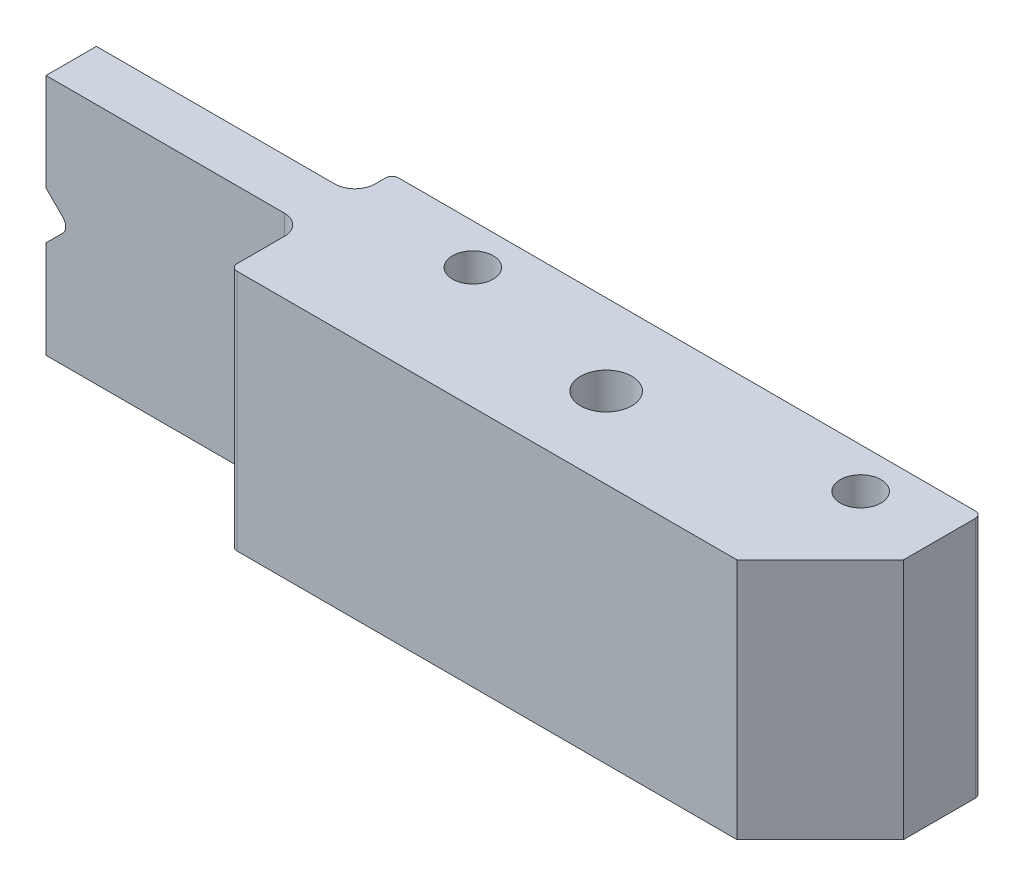
from build123d import *

# Parameters (mm, degrees)
CROQUIS1_W                          = 66.675
CROQUIS1_H                          = 19.05
SALIENTE_EXTRUIR1_DEPTH             = 12.7
CROQUIS2_W                          = 20.32
CROQUIS2_H                          = 2.921
CROQUIS2_H_2                        = 5.8166
CORTAR_EXTRUIR1_DEPTH               = 71.496440513
REDONDEO1_R                         = 1.5875
TALADROS_DE_ESPIGA_DE_1_8_0_126_1_D = 3.2004
TALADRO_ROSCADO_10_321_D            = 4.0386
CORTAR_EXTRUIR2_DEPTH               = 71.496440513
CORTAR_EXTRUIR3_DEPTH               = 71.02918653
CROQUIS10_W                         = 1.346153846
CROQUIS10_H                         = 0.358974359
CORTAR_EXTRUIR4_DEPTH               = 0.381
REDONDEO2_R                         = 0.508


with BuildPart() as part:
    # Croquis1 → Saliente-Extruir1 (new body)
    with BuildSketch(Plane.XY):
        with Locations((33.3375, -9.525)):
            Rectangle(CROQUIS1_W, CROQUIS1_H)
    extrude(amount=SALIENTE_EXTRUIR1_DEPTH)

    # Croquis2 → Cortar-Extruir1 (cut, through all)
    with BuildSketch(Plane(origin=(0, 0, 0), x_dir=(1, 0, 0), z_dir=(0, 1, 0))):
        with Locations((10.16, -1.4605)):
            Rectangle(CROQUIS2_W, CROQUIS2_H)
        with Locations((10.16, -9.7917)):
            Rectangle(CROQUIS2_W, CROQUIS2_H_2)
    extrude(amount=-CORTAR_EXTRUIR1_DEPTH, mode=Mode.SUBTRACT)

    # Redondeo1
    redondeo1_edges = [part.edges().sort_by_distance(p)[0] for p in [
        (20.32, -9.525, 2.921),
        (20.32, -9.525, 6.8834),
    ]]
    fillet(redondeo1_edges, radius=REDONDEO1_R)

    # Taladros de espiga de 1/8 (0.126)1 (through all)
    with Locations(Plane(origin=(0, 0, 0), x_dir=(1, 0, 0), z_dir=(0, 1, 0))):
        with Locations((60.325, -3.175), (29.845, -3.175)):
            Hole(TALADROS_DE_ESPIGA_DE_1_8_0_126_1_D / 2)

    # Taladro roscado #10-321 (through all)
    with Locations(Plane(origin=(0, 0, 0), x_dir=(1, 0, 0), z_dir=(0, 1, 0))):
        with Locations((43.4975, -6.35)):
            Hole(TALADRO_ROSCADO_10_321_D / 2)

    # Croquis7 → Cortar-Extruir2 (cut, through all)
    with BuildSketch(Plane(origin=(0, 0, 0), x_dir=(1, 0, 0), z_dir=(0, 1, 0))):
        Polygon((66.675, -6.1468), (60.1218, -12.7), (66.675, -12.7), align=None)
    extrude(amount=-CORTAR_EXTRUIR2_DEPTH, mode=Mode.SUBTRACT)

    # Croquis8 → Cortar-Extruir3 (cut, through all)
    with BuildSketch(Plane(origin=(0, 0, 2.921), x_dir=(-1, 0, 0), z_dir=(0, 0, -1))):
        with BuildLine():
            Line((0, -7.659969265), (-1.326215367, -8.986184633))
            ThreePointArc((-1.326215367, -8.986184633), (-1.5494, -9.525), (-1.326215367, -10.063815367))
            Line((-1.326215367, -10.063815367), (0, -11.390030735))
            Line((0, -11.390030735), (0, -7.659969265))
        make_face()
    extrude(amount=-CORTAR_EXTRUIR3_DEPTH, mode=Mode.SUBTRACT)

    # Croquis10 → Cortar-Extruir4 (cut)
    # profile 1 of 12: a face of its own
    with BuildSketch(Plane(origin=(0, 0, 0), x_dir=(-1, 0, 0), z_dir=(0, 0, -1))):
        Polygon((-61.432842809, -12.7), (-60.970803546, -9.2), (-60.925931751, -9.2), (-59.480919732, -12.071794872), (-58.039413321, -9.2), (-57.993840405, -9.2), (-57.528996655, -12.7), (-57.844501463, -12.7), (-58.17963768, -10.181570513), (-59.443059155, -12.7), (-59.513872456, -12.7), (-60.782201783, -10.175961538), (-61.116636879, -12.7), align=None)
    # profile 2 of 12: a face of its own
    with BuildSketch(Plane(origin=(0, 0, 0), x_dir=(-1, 0, 0), z_dir=(0, 0, -1))):
        Polygon((-56.990535116, -12.7), (-56.528495854, -9.2), (-56.483624059, -9.2), (-55.038612039, -12.071794872), (-53.597105629, -9.2), (-53.551532713, -9.2), (-53.086688963, -12.7), (-53.40219377, -12.7), (-53.737329988, -10.181570513), (-55.000751463, -12.7), (-55.071564764, -12.7), (-56.339894091, -10.175961538), (-56.674329187, -12.7), align=None)
    # profile 3 of 12: a face of its own
    with BuildSketch(Plane(origin=(0, 0, 0), x_dir=(-1, 0, 0), z_dir=(0, 0, -1))):
        with BuildLine():
            Line((-50.57386845, -12.78974359), (-50.824870052, -12.615164263))
            Line((-50.824870052, -12.615164263), (-49.851713001, -11.192588141))
            add(Edge.make_bspline(
                [(-49.851713001, -11.192588141), (-49.913803737, -11.200181204), (-50.036063857, -11.215132369), (-50.159200959, -11.217879024), (-50.219801943, -11.219230769)],
                knots=[0, 0, 0, 0, 1.015715272, 2, 2, 2, 2], degree=3))
            add(Edge.make_bspline(
                [(-50.219801943, -11.219230769), (-50.256543991, -11.218289693), (-50.328665418, -11.216442442), (-50.43469707, -11.201800634), (-50.536582631, -11.179250506), (-50.634051987, -11.145601751), (-50.727471492, -11.103783542), (-50.816637205, -11.051926528), (-50.901429096, -10.990920237), (-50.980936506, -10.921087245), (-51.053248245, -10.844409193), (-51.117671542, -10.76325355), (-51.171212674, -10.676677579), (-51.21568926, -10.586447359), (-51.249419713, -10.491266009), (-51.273982251, -10.392216608), (-51.289104605, -10.288604966), (-51.290903701, -10.218079836), (-51.291817168, -10.182271635)],
                knots=[0, 0, 0, 0, 1.060718605, 2.082097864, 3.085795603, 4.069760067, 5.054557537, 6.03741023, 7.043284206, 8.066802108, 9.088538119, 10.083643548, 11.053783639, 12.022749082, 12.983451788, 13.964007469, 14.966251758, 16, 16, 16, 16], degree=3))
            add(Edge.make_bspline(
                [(-51.291817168, -10.182271635), (-51.290082733, -10.133302982), (-51.286678389, -10.03718745), (-51.259279872, -9.896753681), (-51.214219533, -9.763967138), (-51.151391156, -9.639176944), (-51.072256435, -9.524178205), (-50.977147844, -9.420569595), (-50.86664388, -9.329824742), (-50.743261861, -9.251820664), (-50.60990884, -9.189085667), (-50.470240182, -9.142846366), (-50.325326062, -9.115647619), (-50.227158392, -9.112061757), (-50.177734636, -9.11025641)],
                knots=[0, 0, 0, 0, 1.022988612, 2.007919123, 2.978103895, 3.94594894, 4.918897164, 5.887013414, 6.875921846, 7.89917871, 8.930658928, 9.948724884, 10.967259574, 12, 12, 12, 12], degree=3))
            add(Edge.make_bspline(
                [(-50.177734636, -9.11025641), (-50.129246216, -9.112086573), (-50.033437669, -9.115702803), (-49.892548663, -9.142186772), (-49.757607646, -9.186823445), (-49.629362659, -9.248508009), (-49.510623247, -9.325828916), (-49.403847436, -9.41796344), (-49.311471896, -9.524968967), (-49.233648016, -9.644257457), (-49.171177975, -9.772424439), (-49.126105692, -9.906208361), (-49.098360053, -10.044647082), (-49.094863726, -10.138441556), (-49.093099219, -10.185777244)],
                knots=[0, 0, 0, 0, 1.026385292, 2.028040595, 3.023318987, 4.028184125, 5.03290303, 6.015178782, 7.004435299, 8.016004309, 9.023023918, 10.015172535, 10.998308025, 12, 12, 12, 12], degree=3))
            add(Edge.make_bspline(
                [(-49.093099219, -10.185777244), (-49.094277628, -10.222521011), (-49.096667736, -10.297046551), (-49.113404043, -10.410276894), (-49.141824228, -10.525728124), (-49.174075927, -10.623449719), (-49.205208094, -10.704158169), (-49.234509226, -10.767909749), (-49.26702138, -10.835011013), (-49.304940145, -10.90475835), (-49.345702442, -10.978040885), (-49.391761718, -11.054123601), (-49.44206729, -11.133108594), (-49.47789701, -11.186355682), (-49.496244251, -11.213621795)],
                knots=[0, 0, 0, 0, 1.179839688, 2.393009684, 3.667231171, 4.993948276, 5.694988576, 6.444077775, 7.246288328, 8.089075292, 8.993003841, 9.939041771, 10.944649915, 12, 12, 12, 12], degree=3))
            Line((-49.496244251, -11.213621795), (-50.57386845, -12.78974359))
        make_face()
        with BuildLine():
            add(Edge.make_bspline(
                [(-50.161608834, -10.86025641), (-50.13377482, -10.859496026), (-50.079591457, -10.858015818), (-50.000214158, -10.849006576), (-49.925289955, -10.83303259), (-49.854618705, -10.810112878), (-49.787491803, -10.782456209), (-49.724975475, -10.747244223), (-49.6670174, -10.705227588), (-49.613229473, -10.658017572), (-49.565465473, -10.605566989), (-49.522922443, -10.550669882), (-49.486761875, -10.493085272), (-49.458198598, -10.43209201), (-49.434714023, -10.369174801), (-49.418496011, -10.303320446), (-49.409511677, -10.234872045), (-49.407980102, -10.188373387), (-49.407201783, -10.16474359)],
                knots=[0, 0, 0, 0, 1.163407946, 2.26475976, 3.333800367, 4.359385343, 5.366239384, 6.363380779, 7.350133999, 8.353570782, 9.349036268, 10.310270964, 11.253520213, 12.184142, 13.120487599, 14.056272588, 15.012232024, 16, 16, 16, 16], degree=3))
            add(Edge.make_bspline(
                [(-49.407201783, -10.16474359), (-49.407871452, -10.141103925), (-49.409191117, -10.094519065), (-49.419778417, -10.025969325), (-49.43840364, -9.960276064), (-49.463394125, -9.897079634), (-49.496314363, -9.836899262), (-49.535817849, -9.77897939), (-49.582750298, -9.723687262), (-49.636752865, -9.672323279), (-49.694987418, -9.62497538), (-49.757047918, -9.583189304), (-49.822422834, -9.548168107), (-49.890713324, -9.519269137), (-49.962061673, -9.496717362), (-50.036425661, -9.480499997), (-50.114181066, -9.471528243), (-50.166962352, -9.470006348), (-50.193860437, -9.469230769)],
                knots=[0, 0, 0, 0, 0.972161553, 1.915763587, 2.844109794, 3.775983486, 4.705125789, 5.659731448, 6.655561913, 7.682237399, 8.721216875, 9.739758359, 10.754845918, 11.767244016, 12.7857855, 13.828538656, 14.893392813, 16, 16, 16, 16], degree=3))
            add(Edge.make_bspline(
                [(-50.193860437, -9.469230769), (-50.22052459, -9.470007601), (-50.27283944, -9.471531738), (-50.349903599, -9.480482943), (-50.423764767, -9.496826428), (-50.494906387, -9.519258691), (-50.563194848, -9.548170263), (-50.62856668, -9.583191139), (-50.690641697, -9.624965761), (-50.748820418, -9.672360533), (-50.80291834, -9.72344818), (-50.849043869, -9.779221608), (-50.888637761, -9.836869133), (-50.921512764, -9.897087641), (-50.946515281, -9.960273927), (-50.965137283, -10.025969904), (-50.975725448, -10.094518914), (-50.977044995, -10.141103874), (-50.977714604, -10.16474359)],
                knots=[0, 0, 0, 0, 1.099389452, 2.15699305, 3.192601482, 4.213358962, 5.227959689, 6.245255729, 7.266013209, 8.307253147, 9.336162325, 10.327954924, 11.284637477, 12.215801273, 13.149702402, 14.080068371, 15.025723358, 16, 16, 16, 16], degree=3))
            add(Edge.make_bspline(
                [(-50.977714604, -10.16474359), (-50.977108677, -10.188391788), (-50.97591368, -10.235030365), (-50.964385891, -10.303556758), (-50.945107611, -10.369244952), (-50.91928822, -10.432733659), (-50.88528663, -10.493405517), (-50.843562782, -10.550972879), (-50.794657236, -10.606088329), (-50.739223748, -10.657895541), (-50.678555587, -10.705447716), (-50.613758841, -10.746978098), (-50.545949004, -10.782050543), (-50.474887374, -10.810191927), (-50.401100574, -10.83280359), (-50.323925442, -10.848977135), (-50.243617205, -10.857929402), (-50.189207223, -10.859473299), (-50.161608834, -10.86025641)],
                knots=[0, 0, 0, 0, 0.952633368, 1.87876736, 2.791047057, 3.707742249, 4.635551637, 5.587206343, 6.568248508, 7.601284464, 8.641511608, 9.671105535, 10.699146789, 11.713763218, 12.747829548, 13.806491675, 14.887386225, 16, 16, 16, 16], degree=3))
        make_face(mode=Mode.SUBTRACT)
    # profile 4 of 12: a face of its own
    with BuildSketch(Plane(origin=(0, 0, 0), x_dir=(-1, 0, 0), z_dir=(0, 0, -1))):
        with BuildLine():
            add(Edge.make_bspline(
                [(-48.64438127, -10.951402244), (-48.644053252, -10.895304856), (-48.643416072, -10.786334872), (-48.636327651, -10.62755023), (-48.624552309, -10.478589941), (-48.608414936, -10.339446875), (-48.588776956, -10.21008511), (-48.562561469, -10.090850353), (-48.532748667, -9.981190746), (-48.498196221, -9.880748698), (-48.459208432, -9.788170995), (-48.416774171, -9.701745793), (-48.369209377, -9.621603861), (-48.319232464, -9.546466071), (-48.264820392, -9.477562376), (-48.207521602, -9.413919713), (-48.145099725, -9.357008963), (-48.079676717, -9.305162661), (-48.010660253, -9.259713189), (-47.940017586, -9.21968045), (-47.867262481, -9.185480583), (-47.792196298, -9.158590147), (-47.71549374, -9.1363793), (-47.636886673, -9.121190353), (-47.556245309, -9.111633444), (-47.501813874, -9.110719776), (-47.474208995, -9.11025641)],
                knots=[0, 0, 0, 0, 1.646270934, 3.197905019, 4.663502075, 6.030701355, 7.308322542, 8.50163776, 9.611534131, 10.641858119, 11.616356847, 12.558055219, 13.465016945, 14.349605745, 15.204443733, 16.039544428, 16.859896111, 17.680448484, 18.487036065, 19.28249412, 20.06191084, 20.843045899, 21.620316918, 22.403196591, 23.190181807, 24, 24, 24, 24], degree=3))
            add(Edge.make_bspline(
                [(-47.474208995, -9.11025641), (-47.446373516, -9.110744225), (-47.391017507, -9.111714336), (-47.309177132, -9.121038279), (-47.22922745, -9.136509402), (-47.151509312, -9.158430377), (-47.075384325, -9.185626053), (-47.001447917, -9.21971317), (-46.929240836, -9.259392038), (-46.859910548, -9.306015915), (-46.792695933, -9.357998191), (-46.72924797, -9.41676086), (-46.669560884, -9.481710579), (-46.612885579, -9.552152443), (-46.560829981, -9.629437528), (-46.511256549, -9.712221638), (-46.466884513, -9.801952503), (-46.424149838, -9.89713297), (-46.387262851, -10.000396629), (-46.353996606, -10.11116139), (-46.327117638, -10.230735577), (-46.304728365, -10.358491822), (-46.287383469, -10.494899305), (-46.274750827, -10.639665621), (-46.268077742, -10.792886011), (-46.266821041, -10.89764386), (-46.266176142, -10.951402244)],
                knots=[0, 0, 0, 0, 0.810914788, 1.612654377, 2.396697861, 3.181598691, 3.963628158, 4.749916497, 5.551656086, 6.361998678, 7.18212741, 8.025565596, 8.878627764, 9.750805457, 10.657531673, 11.591944965, 12.560506719, 13.57287815, 14.630710178, 15.753379473, 16.941251878, 18.199788006, 19.531962791, 20.947069417, 22.433333509, 24, 24, 24, 24], degree=3))
            add(Edge.make_bspline(
                [(-46.266176142, -10.951402244), (-46.266827727, -11.004926152), (-46.268097312, -11.109215303), (-46.274676019, -11.261746279), (-46.28763465, -11.405744322), (-46.303844639, -11.541554784), (-46.326295602, -11.668612403), (-46.353900768, -11.787356852), (-46.384551091, -11.898300923), (-46.422385885, -12.000535735), (-46.463796595, -12.095487458), (-46.508851791, -12.184154606), (-46.557121617, -12.267320899), (-46.609710362, -12.344320646), (-46.665763776, -12.415699303), (-46.726481564, -12.480196926), (-46.79015215, -12.539367598), (-46.857564565, -12.592019225), (-46.927976117, -12.63810403), (-46.999935194, -12.67931788), (-47.074718577, -12.712550575), (-47.15063153, -12.741085616), (-47.228759896, -12.762886068), (-47.309006286, -12.777959923), (-47.390962522, -12.788531772), (-47.446364087, -12.789338252), (-47.474208995, -12.78974359)],
                knots=[0, 0, 0, 0, 1.561518951, 3.042555995, 4.452378317, 5.7783523, 7.031515105, 8.214008947, 9.334062868, 10.386615937, 11.391082383, 12.354592575, 13.286541444, 14.194233754, 15.072674879, 15.931287219, 16.775624067, 17.606195743, 18.42308326, 19.229000347, 20.022332153, 20.807536673, 21.593273796, 22.3848459, 23.188221202, 24, 24, 24, 24], degree=3))
            add(Edge.make_bspline(
                [(-47.474208995, -12.78974359), (-47.501813109, -12.789277234), (-47.556243033, -12.788357672), (-47.636895459, -12.778843941), (-47.715177902, -12.763548438), (-47.791476656, -12.742131834), (-47.866183171, -12.715916997), (-47.938279458, -12.681763314), (-48.008567142, -12.642429245), (-48.076858698, -12.597633823), (-48.141870859, -12.54631214), (-48.203969464, -12.489547851), (-48.261594483, -12.42592444), (-48.315228579, -12.356446517), (-48.366202667, -12.281753275), (-48.41309204, -12.200824902), (-48.456462894, -12.113982291), (-48.496106385, -12.02066438), (-48.531255049, -11.919509453), (-48.562302757, -11.809360274), (-48.586816914, -11.689244638), (-48.607799869, -11.560127271), (-48.624724252, -11.421453341), (-48.636278578, -11.273147562), (-48.643419893, -11.115302353), (-48.644054963, -11.007032579), (-48.64438127, -10.951402244)],
                knots=[0, 0, 0, 0, 0.810891512, 1.598919785, 2.382837074, 3.152667961, 3.926044502, 4.706494248, 5.493654104, 6.291793342, 7.103789334, 7.925228297, 8.761435821, 9.622817696, 10.50288917, 11.416980706, 12.369136599, 13.353924996, 14.394355917, 15.514179734, 16.714354668, 17.994756427, 19.357759367, 20.818452758, 22.365282078, 24, 24, 24, 24], degree=3))
        make_face()
        with BuildLine():
            add(Edge.make_bspline(
                [(-48.330278706, -10.95), (-48.330159259, -10.996748699), (-48.329927436, -11.087478744), (-48.323871235, -11.219322005), (-48.315621003, -11.342292333), (-48.304979706, -11.45654587), (-48.289176757, -11.561695882), (-48.27146997, -11.658465565), (-48.24992188, -11.746342803), (-48.224426862, -11.825930613), (-48.195387765, -11.898579682), (-48.163681902, -11.966180897), (-48.129621179, -12.029532833), (-48.091502028, -12.088066442), (-48.049986965, -12.141972606), (-48.006013706, -12.192205438), (-47.957941122, -12.237002419), (-47.891437379, -12.290729274), (-47.803640905, -12.346248408), (-47.693020449, -12.394594498), (-47.579351998, -12.424976954), (-47.502200748, -12.42884071), (-47.463692168, -12.430769231)],
                knots=[0, 0, 0, 0, 1.459021318, 2.831673884, 4.118529203, 5.306027144, 6.411944654, 7.436330062, 8.375795394, 9.233974572, 10.042671642, 10.816086306, 11.563610507, 12.285937304, 12.993564865, 13.685989202, 14.367179055, 15.041617293, 16.353048772, 17.594441528, 18.799311195, 20, 20, 20, 20], degree=3))
            add(Edge.make_bspline(
                [(-47.463692168, -12.430769231), (-47.424934496, -12.42917145), (-47.347499173, -12.425979187), (-47.234365378, -12.39518045), (-47.124535108, -12.34871091), (-47.038463167, -12.293763405), (-46.972980624, -12.241435075), (-46.926063634, -12.196820427), (-46.883001585, -12.14686456), (-46.84215951, -12.092965264), (-46.804700435, -12.03409278), (-46.770637297, -11.970530204), (-46.739553949, -11.902101027), (-46.721844904, -11.854331287), (-46.712790725, -11.829907853)],
                knots=[0, 0, 0, 0, 1.353760809, 2.704726607, 4.075137775, 5.516104923, 6.260822281, 7.007110065, 7.778089737, 8.566572457, 9.372053459, 10.217411131, 11.088608312, 12, 12, 12, 12], degree=3))
            add(Edge.make_bspline(
                [(-46.712790725, -11.829907853), (-46.702238958, -11.798678113), (-46.680814344, -11.735268349), (-46.653202569, -11.636904697), (-46.63145717, -11.533701933), (-46.611893804, -11.426276816), (-46.598540749, -11.313837115), (-46.587792935, -11.196730731), (-46.581462248, -11.074869369), (-46.580677497, -10.992074378), (-46.580278706, -10.95)],
                knots=[0, 0, 0, 0, 0.884706709, 1.796334032, 2.740027952, 3.714592787, 4.726048262, 5.777819803, 6.87074269, 8, 8, 8, 8], degree=3))
            add(Edge.make_bspline(
                [(-46.580278706, -10.95), (-46.580828895, -10.907932427), (-46.581905183, -10.825639263), (-46.586019171, -10.705121082), (-46.596642745, -10.590653321), (-46.608441864, -10.481742848), (-46.625839085, -10.378992546), (-46.644596892, -10.281542241), (-46.669798104, -10.190599216), (-46.696717879, -10.104739634), (-46.727528275, -10.024938979), (-46.761444009, -9.950825193), (-46.797665768, -9.882040468), (-46.837008008, -9.818773527), (-46.879003691, -9.760740984), (-46.924761241, -9.709106389), (-46.972465613, -9.662269421), (-47.039282799, -9.608806852), (-47.126757089, -9.554295157), (-47.235602736, -9.504129397), (-47.348873381, -9.475321104), (-47.425446835, -9.471259417), (-47.463692168, -9.469230769)],
                knots=[0, 0, 0, 0, 1.31362396, 2.569729283, 3.763502607, 4.902122613, 5.988968491, 7.01645872, 7.998833611, 8.933434873, 9.825090667, 10.667526885, 11.477055099, 12.250526234, 12.991942729, 13.710640831, 14.402115721, 15.076753259, 16.378508321, 17.609869233, 18.806226677, 20, 20, 20, 20], degree=3))
            add(Edge.make_bspline(
                [(-47.463692168, -9.469230769), (-47.50240276, -9.471262216), (-47.579894465, -9.47532881), (-47.69434242, -9.504022064), (-47.804046772, -9.55403503), (-47.891289746, -9.608987402), (-47.958153533, -9.661325713), (-48.005236226, -9.706712167), (-48.049382398, -9.756358422), (-48.090050099, -9.810760337), (-48.128139382, -9.869225704), (-48.163120394, -9.932214469), (-48.194637724, -10.000045833), (-48.22372226, -10.072662268), (-48.249295048, -10.152243213), (-48.270389012, -10.240012206), (-48.289876065, -10.336474098), (-48.303671334, -10.442193606), (-48.315935089, -10.55647576), (-48.323816437, -10.679753078), (-48.329947695, -10.811817458), (-48.330166159, -10.903016617), (-48.330278706, -10.95)],
                knots=[0, 0, 0, 0, 1.207732386, 2.417664972, 3.655092373, 4.956220595, 5.625982001, 6.301752483, 6.994047911, 7.697131622, 8.419323945, 9.170223765, 9.943494443, 10.752040957, 11.610060368, 12.549350801, 13.567764191, 14.679664412, 15.874934091, 17.154273443, 18.533957287, 20, 20, 20, 20], degree=3))
        make_face(mode=Mode.SUBTRACT)
    # profile 5 of 12: a face of its own
    with BuildSketch(Plane(origin=(0, 0, 0), x_dir=(-1, 0, 0), z_dir=(0, 0, -1))):
        with Locations((-45.278996655, -11.353846154)):
            Rectangle(CROQUIS10_W, CROQUIS10_H)
    # profile 6 of 12: a face of its own
    with BuildSketch(Plane(origin=(0, 0, 0), x_dir=(-1, 0, 0), z_dir=(0, 0, -1))):
        Polygon((-42.426132071, -9.11025641), (-42.362329988, -9.11025641), (-42.362329988, -11.533333333), (-41.958483834, -11.533333333), (-41.958483834, -11.892307692), (-42.362329988, -11.892307692), (-42.362329988, -12.7), (-42.676432552, -12.7), (-42.676432552, -11.892307692), (-44.336688963, -11.892307692), align=None)
        Polygon((-42.676432552, -11.533333333), (-42.676432552, -10.013301282), (-43.719701783, -11.533333333), align=None, mode=Mode.SUBTRACT)
    # profile 7 of 12: a face of its own
    with BuildSketch(Plane(origin=(0, 0, 0), x_dir=(-1, 0, 0), z_dir=(0, 0, -1))):
        Polygon((-40.900491046, -9.2), (-40.253355629, -9.2), (-40.253355629, -12.7), (-40.567458193, -12.7), (-40.567458193, -9.558974359), (-41.105919732, -9.558974359), align=None)
    # profile 8 of 12: a face of its own
    with BuildSketch(Plane(origin=(0, 0, 0), x_dir=(-1, 0, 0), z_dir=(0, 0, -1))):
        with BuildLine():
            Line((-36.753355629, -9.2), (-36.753355629, -9.558974359))
            Line((-36.753355629, -9.558974359), (-37.943860437, -9.558974359))
            Line((-37.943860437, -9.558974359), (-38.1324622, -10.479547276))
            add(Edge.make_bspline(
                [(-38.1324622, -10.479547276), (-38.095406325, -10.469317004), (-38.023616429, -10.44949747), (-37.917656569, -10.4274917), (-37.817064365, -10.414226256), (-37.751788995, -10.412414945), (-37.720202584, -10.411538462)],
                knots=[0, 0, 0, 0, 1.100273476, 2.13160584, 3.095893838, 4, 4, 4, 4], degree=3))
            add(Edge.make_bspline(
                [(-37.720202584, -10.411538462), (-37.681118845, -10.412384397), (-37.604270447, -10.414047718), (-37.4918315, -10.430019568), (-37.384498607, -10.455159482), (-37.282496237, -10.490280004), (-37.185635686, -10.535189737), (-37.094808125, -10.591289678), (-37.008650212, -10.656823009), (-36.928707618, -10.732168021), (-36.85618331, -10.815089637), (-36.79241732, -10.904247508), (-36.73825473, -10.998775171), (-36.694693975, -11.099575779), (-36.659909641, -11.205534933), (-36.636757646, -11.317767515), (-36.621340937, -11.435215635), (-36.61961855, -11.515520205), (-36.618740245, -11.556470353)],
                knots=[0, 0, 0, 0, 1.052922333, 2.070308379, 3.05430497, 4.020497103, 4.973039431, 5.925935799, 6.892292201, 7.88610001, 8.88166317, 9.857072816, 10.836096531, 11.812156883, 12.81219415, 13.836441305, 14.89672472, 16, 16, 16, 16], degree=3))
            add(Edge.make_bspline(
                [(-36.618740245, -11.556470353), (-36.61940532, -11.584992573), (-36.620726482, -11.64165156), (-36.62744507, -11.725795761), (-36.640380786, -11.808158594), (-36.65774851, -11.888750986), (-36.680290928, -11.967420358), (-36.707579982, -12.044391886), (-36.74097601, -12.119186493), (-36.777607385, -12.192511888), (-36.818853863, -12.262710395), (-36.86463237, -12.328359382), (-36.912997862, -12.390443663), (-36.965039247, -12.448297396), (-37.021240242, -12.501540414), (-37.080920209, -12.550488696), (-37.143602928, -12.595970026), (-37.21025817, -12.636138221), (-37.279400653, -12.673101177), (-37.35202887, -12.703424715), (-37.426489571, -12.730535243), (-37.503854446, -12.75214477), (-37.583948259, -12.769077325), (-37.666903035, -12.780577925), (-37.752283705, -12.788954363), (-37.810158717, -12.78947872), (-37.839393289, -12.78974359)],
                knots=[0, 0, 0, 0, 1.056347294, 2.098418968, 3.122841568, 4.141288669, 5.149314143, 6.15115421, 7.162517403, 8.180376062, 9.185164535, 10.17417709, 11.141909838, 12.097768115, 13.052685741, 14.0056014, 14.954263652, 15.917497458, 16.885230207, 17.854509472, 18.828990115, 19.81800267, 20.826176721, 21.857883937, 22.917946725, 24, 24, 24, 24], degree=3))
            add(Edge.make_bspline(
                [(-37.839393289, -12.78974359), (-37.87426747, -12.789052752), (-37.942878301, -12.78769361), (-38.043398868, -12.773475124), (-38.140113474, -12.753111208), (-38.232243575, -12.722474938), (-38.320614838, -12.684087643), (-38.404037556, -12.635571472), (-38.484643332, -12.580592368), (-38.559155369, -12.515712015), (-38.628311483, -12.444796333), (-38.690217991, -12.367838692), (-38.745351568, -12.28610925), (-38.792829315, -12.199211096), (-38.833327336, -12.107372565), (-38.865142325, -12.010249564), (-38.89082068, -11.90834956), (-38.9016841, -11.83819605), (-38.907201783, -11.802564103)],
                knots=[0, 0, 0, 0, 1.0467383, 2.05933395, 3.04377827, 4.011590433, 4.970194871, 5.932262533, 6.905835911, 7.896367577, 8.894135286, 9.877477877, 10.858688626, 11.851381753, 12.8477658, 13.868841284, 14.917554742, 16, 16, 16, 16], degree=3))
            Line((-38.907201783, -11.802564103), (-38.593099219, -11.802564103))
            add(Edge.make_bspline(
                [(-38.593099219, -11.802564103), (-38.585370662, -11.835940555), (-38.570515945, -11.90009195), (-38.537910196, -11.990223291), (-38.498044321, -12.070542515), (-38.450639972, -12.142112098), (-38.394089942, -12.204521095), (-38.329560513, -12.260138157), (-38.25721279, -12.310313287), (-38.17681956, -12.352136054), (-38.092006481, -12.387804807), (-38.003239271, -12.411556502), (-37.912934925, -12.428257395), (-37.851856554, -12.429929156), (-37.821164123, -12.430769231)],
                knots=[0, 0, 0, 0, 1.136247022, 2.183929868, 3.172523383, 4.106158343, 5.02341133, 5.958108904, 6.928429099, 7.938127109, 8.96079061, 9.975095812, 10.982467395, 12, 12, 12, 12], degree=3))
            add(Edge.make_bspline(
                [(-37.821164123, -12.430769231), (-37.791205678, -12.429948453), (-37.732217256, -12.428332334), (-37.645405869, -12.415893322), (-37.561592995, -12.396735751), (-37.481605639, -12.368065896), (-37.404044099, -12.333221178), (-37.330870329, -12.288506102), (-37.259967451, -12.237046083), (-37.193539318, -12.178089453), (-37.132699869, -12.113119759), (-37.078943747, -12.043642365), (-37.034166834, -11.969525519), (-36.996432725, -11.892052366), (-36.967779426, -11.810373809), (-36.947338445, -11.724872634), (-36.935335386, -11.635337653), (-36.933684206, -11.574268344), (-36.932842809, -11.543149038)],
                knots=[0, 0, 0, 0, 1.027316725, 2.022795036, 3.002884548, 3.971462791, 4.93288096, 5.914575861, 6.907176829, 7.935150275, 8.956128384, 9.956726525, 10.942570165, 11.921478529, 12.907843606, 13.90538589, 14.932640048, 16, 16, 16, 16], degree=3))
            add(Edge.make_bspline(
                [(-36.932842809, -11.543149038), (-36.933501288, -11.515073287), (-36.934790168, -11.460118998), (-36.945320738, -11.379719791), (-36.963637711, -11.303646749), (-36.989061591, -11.231532515), (-37.021341098, -11.163309073), (-37.060787411, -11.098906013), (-37.108140809, -11.039172179), (-37.162232697, -10.984079626), (-37.221490738, -10.933234751), (-37.286934481, -10.889890664), (-37.357194408, -10.853426747), (-37.431424007, -10.821958748), (-37.511388906, -10.799358003), (-37.595505538, -10.782390118), (-37.684682246, -10.772574755), (-37.745652934, -10.771212866), (-37.77699345, -10.770512821)],
                knots=[0, 0, 0, 0, 1.045622112, 2.046656509, 3.013763289, 3.955457236, 4.890082067, 5.820317437, 6.762574623, 7.722996705, 8.69280354, 9.665887285, 10.63943826, 11.638615906, 12.663482002, 13.728887084, 14.832589034, 16, 16, 16, 16], degree=3))
            add(Edge.make_bspline(
                [(-37.77699345, -10.770512821), (-37.804122379, -10.771093412), (-37.860136734, -10.772292185), (-37.946059561, -10.781118682), (-38.036351284, -10.795357976), (-38.130665779, -10.814944224), (-38.229286287, -10.840575301), (-38.332004688, -10.871289801), (-38.439036955, -10.9080118), (-38.511154679, -10.935744014), (-38.548227424, -10.95)],
                knots=[0, 0, 0, 0, 0.817624296, 1.688186739, 2.600797293, 3.572016777, 4.590301741, 5.671205678, 6.80286297, 8, 8, 8, 8], degree=3))
            Line((-38.548227424, -10.95), (-38.189253065, -9.2))
            Line((-38.189253065, -9.2), (-36.753355629, -9.2))
        make_face()
    # profile 9 of 12: a face of its own
    with BuildSketch(Plane(origin=(0, 0, 0), x_dir=(-1, 0, 0), z_dir=(0, 0, -1))):
        with BuildLine():
            add(Edge.make_bspline(
                [(-36.259765886, -10.951402244), (-36.259437867, -10.895304856), (-36.258800687, -10.786334872), (-36.251712266, -10.62755023), (-36.239936924, -10.478589941), (-36.223799551, -10.339446875), (-36.204161571, -10.21008511), (-36.177946085, -10.090850353), (-36.148133282, -9.981190746), (-36.113580836, -9.880748698), (-36.074593047, -9.788170995), (-36.032158786, -9.701745793), (-35.984593992, -9.621603861), (-35.934617079, -9.546466071), (-35.880205007, -9.477562376), (-35.822906217, -9.413919713), (-35.760484341, -9.357008963), (-35.695061332, -9.305162661), (-35.626044868, -9.259713189), (-35.555402202, -9.21968045), (-35.482647096, -9.185480583), (-35.407580913, -9.158590147), (-35.330878355, -9.1363793), (-35.252271288, -9.121190353), (-35.171629925, -9.111633444), (-35.11719849, -9.110719776), (-35.08959361, -9.11025641)],
                knots=[0, 0, 0, 0, 1.646270934, 3.197905019, 4.663502075, 6.030701355, 7.308322542, 8.50163776, 9.611534131, 10.641858119, 11.616356847, 12.558055219, 13.465016945, 14.349605745, 15.204443733, 16.039544428, 16.859896111, 17.680448484, 18.487036065, 19.28249412, 20.06191084, 20.843045899, 21.620316918, 22.403196591, 23.190181807, 24, 24, 24, 24], degree=3))
            add(Edge.make_bspline(
                [(-35.08959361, -9.11025641), (-35.061758131, -9.110744225), (-35.006402123, -9.111714336), (-34.924561747, -9.121038279), (-34.844612066, -9.136509402), (-34.766893927, -9.158430377), (-34.69076894, -9.185626053), (-34.616832533, -9.21971317), (-34.544625451, -9.259392038), (-34.475295164, -9.306015915), (-34.408080548, -9.357998191), (-34.344632585, -9.41676086), (-34.284945499, -9.481710579), (-34.228270194, -9.552152443), (-34.176214597, -9.629437528), (-34.126641165, -9.712221638), (-34.082269129, -9.801952503), (-34.039534454, -9.89713297), (-34.002647467, -10.000396629), (-33.969381222, -10.11116139), (-33.942502253, -10.230735577), (-33.920112981, -10.358491822), (-33.902768085, -10.494899305), (-33.890135443, -10.639665621), (-33.883462358, -10.792886011), (-33.882205656, -10.89764386), (-33.881560757, -10.951402244)],
                knots=[0, 0, 0, 0, 0.810914788, 1.612654377, 2.396697861, 3.181598691, 3.963628158, 4.749916497, 5.551656086, 6.361998678, 7.18212741, 8.025565596, 8.878627764, 9.750805457, 10.657531673, 11.591944965, 12.560506719, 13.57287815, 14.630710178, 15.753379473, 16.941251878, 18.199788006, 19.531962791, 20.947069417, 22.433333509, 24, 24, 24, 24], degree=3))
            add(Edge.make_bspline(
                [(-33.881560757, -10.951402244), (-33.882212342, -11.004926152), (-33.883481928, -11.109215303), (-33.890060635, -11.261746279), (-33.903019266, -11.405744322), (-33.919229254, -11.541554784), (-33.941680217, -11.668612403), (-33.969285383, -11.787356852), (-33.999935706, -11.898300923), (-34.0377705, -12.000535735), (-34.079181211, -12.095487458), (-34.124236407, -12.184154606), (-34.172506233, -12.267320899), (-34.225094978, -12.344320646), (-34.281148391, -12.415699303), (-34.34186618, -12.480196926), (-34.405536765, -12.539367598), (-34.472949181, -12.592019225), (-34.543360732, -12.63810403), (-34.615319809, -12.67931788), (-34.690103192, -12.712550575), (-34.766016145, -12.741085616), (-34.844144511, -12.762886068), (-34.924390902, -12.777959923), (-35.006347138, -12.788531772), (-35.061748703, -12.789338252), (-35.08959361, -12.78974359)],
                knots=[0, 0, 0, 0, 1.561518951, 3.042555995, 4.452378317, 5.7783523, 7.031515105, 8.214008947, 9.334062868, 10.386615937, 11.391082383, 12.354592575, 13.286541444, 14.194233754, 15.072674879, 15.931287219, 16.775624067, 17.606195743, 18.42308326, 19.229000347, 20.022332153, 20.807536673, 21.593273796, 22.3848459, 23.188221202, 24, 24, 24, 24], degree=3))
            add(Edge.make_bspline(
                [(-35.08959361, -12.78974359), (-35.117197724, -12.789277234), (-35.171627649, -12.788357672), (-35.252280074, -12.778843941), (-35.330562518, -12.763548438), (-35.406861272, -12.742131834), (-35.481567787, -12.715916997), (-35.553664073, -12.681763314), (-35.623951757, -12.642429245), (-35.692243313, -12.597633823), (-35.757255474, -12.54631214), (-35.819354079, -12.489547851), (-35.876979099, -12.42592444), (-35.930613194, -12.356446517), (-35.981587282, -12.281753275), (-36.028476656, -12.200824902), (-36.07184751, -12.113982291), (-36.111491, -12.02066438), (-36.146639664, -11.919509453), (-36.177687372, -11.809360274), (-36.202201529, -11.689244638), (-36.223184485, -11.560127271), (-36.240108868, -11.421453341), (-36.251663193, -11.273147562), (-36.258804508, -11.115302353), (-36.259439579, -11.007032579), (-36.259765886, -10.951402244)],
                knots=[0, 0, 0, 0, 0.810891512, 1.598919785, 2.382837074, 3.152667961, 3.926044502, 4.706494248, 5.493654104, 6.291793342, 7.103789334, 7.925228297, 8.761435821, 9.622817696, 10.50288917, 11.416980706, 12.369136599, 13.353924996, 14.394355917, 15.514179734, 16.714354668, 17.994756427, 19.357759367, 20.818452758, 22.365282078, 24, 24, 24, 24], degree=3))
        make_face()
        with BuildLine():
            add(Edge.make_bspline(
                [(-35.945663321, -10.95), (-35.945543874, -10.996748699), (-35.945312051, -11.087478744), (-35.939255851, -11.219322005), (-35.931005619, -11.342292333), (-35.920364321, -11.45654587), (-35.904561373, -11.561695882), (-35.886854585, -11.658465565), (-35.865306495, -11.746342803), (-35.839811478, -11.825930613), (-35.810772381, -11.898579682), (-35.779066517, -11.966180897), (-35.745005794, -12.029532833), (-35.706886644, -12.088066442), (-35.66537158, -12.141972606), (-35.621398321, -12.192205438), (-35.573325737, -12.237002419), (-35.506821994, -12.290729274), (-35.41902552, -12.346248408), (-35.308405065, -12.394594498), (-35.194736614, -12.424976954), (-35.117585364, -12.42884071), (-35.079076783, -12.430769231)],
                knots=[0, 0, 0, 0, 1.459021318, 2.831673884, 4.118529203, 5.306027144, 6.411944654, 7.436330062, 8.375795394, 9.233974572, 10.042671642, 10.816086306, 11.563610507, 12.285937304, 12.993564865, 13.685989202, 14.367179055, 15.041617293, 16.353048772, 17.594441528, 18.799311195, 20, 20, 20, 20], degree=3))
            add(Edge.make_bspline(
                [(-35.079076783, -12.430769231), (-35.040319111, -12.42917145), (-34.962883788, -12.425979187), (-34.849749993, -12.39518045), (-34.739919723, -12.34871091), (-34.653847783, -12.293763405), (-34.588365239, -12.241435075), (-34.541448249, -12.196820427), (-34.498386201, -12.14686456), (-34.457544126, -12.092965264), (-34.42008505, -12.03409278), (-34.386021912, -11.970530204), (-34.354938565, -11.902101027), (-34.337229519, -11.854331287), (-34.328175341, -11.829907853)],
                knots=[0, 0, 0, 0, 1.353760809, 2.704726607, 4.075137775, 5.516104923, 6.260822281, 7.007110065, 7.778089737, 8.566572457, 9.372053459, 10.217411131, 11.088608312, 12, 12, 12, 12], degree=3))
            add(Edge.make_bspline(
                [(-34.328175341, -11.829907853), (-34.317623573, -11.798678113), (-34.296198959, -11.735268349), (-34.268587185, -11.636904697), (-34.246841786, -11.533701933), (-34.22727842, -11.426276816), (-34.213925364, -11.313837115), (-34.203177551, -11.196730731), (-34.196846864, -11.074869369), (-34.196062113, -10.992074378), (-34.195663321, -10.95)],
                knots=[0, 0, 0, 0, 0.884706709, 1.796334032, 2.740027952, 3.714592787, 4.726048262, 5.777819803, 6.87074269, 8, 8, 8, 8], degree=3))
            add(Edge.make_bspline(
                [(-34.195663321, -10.95), (-34.196213511, -10.907932427), (-34.197289798, -10.825639263), (-34.201403786, -10.705121082), (-34.212027361, -10.590653321), (-34.22382648, -10.481742848), (-34.241223701, -10.378992546), (-34.259981508, -10.281542241), (-34.28518272, -10.190599216), (-34.312102495, -10.104739634), (-34.34291289, -10.024938979), (-34.376828625, -9.950825193), (-34.413050383, -9.882040468), (-34.452392624, -9.818773527), (-34.494388307, -9.760740984), (-34.540145856, -9.709106389), (-34.587850229, -9.662269421), (-34.654667415, -9.608806852), (-34.742141704, -9.554295157), (-34.850987352, -9.504129397), (-34.964257996, -9.475321104), (-35.04083145, -9.471259417), (-35.079076783, -9.469230769)],
                knots=[0, 0, 0, 0, 1.31362396, 2.569729283, 3.763502607, 4.902122613, 5.988968491, 7.01645872, 7.998833611, 8.933434873, 9.825090667, 10.667526885, 11.477055099, 12.250526234, 12.991942729, 13.710640831, 14.402115721, 15.076753259, 16.378508321, 17.609869233, 18.806226677, 20, 20, 20, 20], degree=3))
            add(Edge.make_bspline(
                [(-35.079076783, -9.469230769), (-35.117787375, -9.471262216), (-35.195279081, -9.47532881), (-35.309727035, -9.504022064), (-35.419431387, -9.55403503), (-35.506674362, -9.608987402), (-35.573538148, -9.661325713), (-35.620620842, -9.706712167), (-35.664767014, -9.756358422), (-35.705434714, -9.810760337), (-35.743523997, -9.869225704), (-35.77850501, -9.932214469), (-35.810022339, -10.000045833), (-35.839106876, -10.072662268), (-35.864679664, -10.152243213), (-35.885773627, -10.240012206), (-35.90526068, -10.336474098), (-35.919055949, -10.442193606), (-35.931319705, -10.55647576), (-35.939201053, -10.679753078), (-35.94533231, -10.811817458), (-35.945550774, -10.903016617), (-35.945663321, -10.95)],
                knots=[0, 0, 0, 0, 1.207732386, 2.417664972, 3.655092373, 4.956220595, 5.625982001, 6.301752483, 6.994047911, 7.697131622, 8.419323945, 9.170223765, 9.943494443, 10.752040957, 11.610060368, 12.549350801, 13.567764191, 14.679664412, 15.874934091, 17.154273443, 18.533957287, 20, 20, 20, 20], degree=3))
        make_face(mode=Mode.SUBTRACT)
    # profile 10 of 12: a face of its own
    with BuildSketch(Plane(origin=(0, 0, 0), x_dir=(-1, 0, 0), z_dir=(0, 0, -1))):
        with Locations((-32.89438127, -11.353846154)):
            Rectangle(CROQUIS10_W, CROQUIS10_H)
    # profile 11 of 12: a face of its own
    with BuildSketch(Plane(origin=(0, 0, 0), x_dir=(-1, 0, 0), z_dir=(0, 0, -1))):
        with BuildLine():
            add(Edge.make_bspline(
                [(-31.952073578, -10.951402244), (-31.95174556, -10.895304856), (-31.95110838, -10.786334872), (-31.944019959, -10.62755023), (-31.932244616, -10.478589941), (-31.916107244, -10.339446875), (-31.896469263, -10.21008511), (-31.870253777, -10.090850353), (-31.840440974, -9.981190746), (-31.805888528, -9.880748698), (-31.766900739, -9.788170995), (-31.724466479, -9.701745793), (-31.676901684, -9.621603861), (-31.626924771, -9.546466071), (-31.5725127, -9.477562376), (-31.515213909, -9.413919713), (-31.452792033, -9.357008963), (-31.387369025, -9.305162661), (-31.31835256, -9.259713189), (-31.247709894, -9.21968045), (-31.174954788, -9.185480583), (-31.099888605, -9.158590147), (-31.023186047, -9.1363793), (-30.944578981, -9.121190353), (-30.863937617, -9.111633444), (-30.809506182, -9.110719776), (-30.781901302, -9.11025641)],
                knots=[0, 0, 0, 0, 1.646270934, 3.197905019, 4.663502075, 6.030701355, 7.308322542, 8.50163776, 9.611534131, 10.641858119, 11.616356847, 12.558055219, 13.465016945, 14.349605745, 15.204443733, 16.039544428, 16.859896111, 17.680448484, 18.487036065, 19.28249412, 20.06191084, 20.843045899, 21.620316918, 22.403196591, 23.190181807, 24, 24, 24, 24], degree=3))
            add(Edge.make_bspline(
                [(-30.781901302, -9.11025641), (-30.754065824, -9.110744225), (-30.698709815, -9.111714336), (-30.61686944, -9.121038279), (-30.536919758, -9.136509402), (-30.459201619, -9.158430377), (-30.383076633, -9.185626053), (-30.309140225, -9.21971317), (-30.236933143, -9.259392038), (-30.167602856, -9.306015915), (-30.100388241, -9.357998191), (-30.036940278, -9.41676086), (-29.977253192, -9.481710579), (-29.920577886, -9.552152443), (-29.868522289, -9.629437528), (-29.818948857, -9.712221638), (-29.774576821, -9.801952503), (-29.731842146, -9.89713297), (-29.694955159, -10.000396629), (-29.661688914, -10.11116139), (-29.634809945, -10.230735577), (-29.612420673, -10.358491822), (-29.595075777, -10.494899305), (-29.582443135, -10.639665621), (-29.57577005, -10.792886011), (-29.574513349, -10.89764386), (-29.57386845, -10.951402244)],
                knots=[0, 0, 0, 0, 0.810914788, 1.612654377, 2.396697861, 3.181598691, 3.963628158, 4.749916497, 5.551656086, 6.361998678, 7.18212741, 8.025565596, 8.878627764, 9.750805457, 10.657531673, 11.591944965, 12.560506719, 13.57287815, 14.630710178, 15.753379473, 16.941251878, 18.199788006, 19.531962791, 20.947069417, 22.433333509, 24, 24, 24, 24], degree=3))
            add(Edge.make_bspline(
                [(-29.57386845, -10.951402244), (-29.574520034, -11.004926152), (-29.57578962, -11.109215303), (-29.582368327, -11.261746279), (-29.595326958, -11.405744322), (-29.611536946, -11.541554784), (-29.633987909, -11.668612403), (-29.661593076, -11.787356852), (-29.692243398, -11.898300923), (-29.730078193, -12.000535735), (-29.771488903, -12.095487458), (-29.816544099, -12.184154606), (-29.864813925, -12.267320899), (-29.91740267, -12.344320646), (-29.973456083, -12.415699303), (-30.034173872, -12.480196926), (-30.097844457, -12.539367598), (-30.165256873, -12.592019225), (-30.235668424, -12.63810403), (-30.307627501, -12.67931788), (-30.382410885, -12.712550575), (-30.458323837, -12.741085616), (-30.536452203, -12.762886068), (-30.616698594, -12.777959923), (-30.69865483, -12.788531772), (-30.754056395, -12.789338252), (-30.781901302, -12.78974359)],
                knots=[0, 0, 0, 0, 1.561518951, 3.042555995, 4.452378317, 5.7783523, 7.031515105, 8.214008947, 9.334062868, 10.386615937, 11.391082383, 12.354592575, 13.286541444, 14.194233754, 15.072674879, 15.931287219, 16.775624067, 17.606195743, 18.42308326, 19.229000347, 20.022332153, 20.807536673, 21.593273796, 22.3848459, 23.188221202, 24, 24, 24, 24], degree=3))
            add(Edge.make_bspline(
                [(-30.781901302, -12.78974359), (-30.809505416, -12.789277234), (-30.863935341, -12.788357672), (-30.944587766, -12.778843941), (-31.02287021, -12.763548438), (-31.099168964, -12.742131834), (-31.173875479, -12.715916997), (-31.245971766, -12.681763314), (-31.316259449, -12.642429245), (-31.384551005, -12.597633823), (-31.449563166, -12.54631214), (-31.511661772, -12.489547851), (-31.569286791, -12.42592444), (-31.622920886, -12.356446517), (-31.673894975, -12.281753275), (-31.720784348, -12.200824902), (-31.764155202, -12.113982291), (-31.803798693, -12.02066438), (-31.838947356, -11.919509453), (-31.869995064, -11.809360274), (-31.894509222, -11.689244638), (-31.915492177, -11.560127271), (-31.93241656, -11.421453341), (-31.943970885, -11.273147562), (-31.951112201, -11.115302353), (-31.951747271, -11.007032579), (-31.952073578, -10.951402244)],
                knots=[0, 0, 0, 0, 0.810891512, 1.598919785, 2.382837074, 3.152667961, 3.926044502, 4.706494248, 5.493654104, 6.291793342, 7.103789334, 7.925228297, 8.761435821, 9.622817696, 10.50288917, 11.416980706, 12.369136599, 13.353924996, 14.394355917, 15.514179734, 16.714354668, 17.994756427, 19.357759367, 20.818452758, 22.365282078, 24, 24, 24, 24], degree=3))
        make_face()
        with BuildLine():
            add(Edge.make_bspline(
                [(-31.637971014, -10.95), (-31.637851567, -10.996748699), (-31.637619743, -11.087478744), (-31.631563543, -11.219322005), (-31.623313311, -11.342292333), (-31.612672014, -11.45654587), (-31.596869065, -11.561695882), (-31.579162277, -11.658465565), (-31.557614188, -11.746342803), (-31.53211917, -11.825930613), (-31.503080073, -11.898579682), (-31.471374209, -11.966180897), (-31.437313486, -12.029532833), (-31.399194336, -12.088066442), (-31.357679273, -12.141972606), (-31.313706013, -12.192205438), (-31.265633429, -12.237002419), (-31.199129687, -12.290729274), (-31.111333212, -12.346248408), (-31.000712757, -12.394594498), (-30.887044306, -12.424976954), (-30.809893056, -12.42884071), (-30.771384475, -12.430769231)],
                knots=[0, 0, 0, 0, 1.459021318, 2.831673884, 4.118529203, 5.306027144, 6.411944654, 7.436330062, 8.375795394, 9.233974572, 10.042671642, 10.816086306, 11.563610507, 12.285937304, 12.993564865, 13.685989202, 14.367179055, 15.041617293, 16.353048772, 17.594441528, 18.799311195, 20, 20, 20, 20], degree=3))
            add(Edge.make_bspline(
                [(-30.771384475, -12.430769231), (-30.732626804, -12.42917145), (-30.65519148, -12.425979187), (-30.542057685, -12.39518045), (-30.432227415, -12.34871091), (-30.346155475, -12.293763405), (-30.280672931, -12.241435075), (-30.233755941, -12.196820427), (-30.190693893, -12.14686456), (-30.149851818, -12.092965264), (-30.112392742, -12.03409278), (-30.078329605, -11.970530204), (-30.047246257, -11.902101027), (-30.029537211, -11.854331287), (-30.020483033, -11.829907853)],
                knots=[0, 0, 0, 0, 1.353760809, 2.704726607, 4.075137775, 5.516104923, 6.260822281, 7.007110065, 7.778089737, 8.566572457, 9.372053459, 10.217411131, 11.088608312, 12, 12, 12, 12], degree=3))
            add(Edge.make_bspline(
                [(-30.020483033, -11.829907853), (-30.009931265, -11.798678113), (-29.988506651, -11.735268349), (-29.960894877, -11.636904697), (-29.939149478, -11.533701933), (-29.919586112, -11.426276816), (-29.906233056, -11.313837115), (-29.895485243, -11.196730731), (-29.889154556, -11.074869369), (-29.888369805, -10.992074378), (-29.887971014, -10.95)],
                knots=[0, 0, 0, 0, 0.884706709, 1.796334032, 2.740027952, 3.714592787, 4.726048262, 5.777819803, 6.87074269, 8, 8, 8, 8], degree=3))
            add(Edge.make_bspline(
                [(-29.887971014, -10.95), (-29.888521203, -10.907932427), (-29.889597491, -10.825639263), (-29.893711478, -10.705121082), (-29.904335053, -10.590653321), (-29.916134172, -10.481742848), (-29.933531393, -10.378992546), (-29.9522892, -10.281542241), (-29.977490412, -10.190599216), (-30.004410187, -10.104739634), (-30.035220583, -10.024938979), (-30.069136317, -9.950825193), (-30.105358076, -9.882040468), (-30.144700316, -9.818773527), (-30.186695999, -9.760740984), (-30.232453548, -9.709106389), (-30.280157921, -9.662269421), (-30.346975107, -9.608806852), (-30.434449397, -9.554295157), (-30.543295044, -9.504129397), (-30.656565688, -9.475321104), (-30.733139142, -9.471259417), (-30.771384475, -9.469230769)],
                knots=[0, 0, 0, 0, 1.31362396, 2.569729283, 3.763502607, 4.902122613, 5.988968491, 7.01645872, 7.998833611, 8.933434873, 9.825090667, 10.667526885, 11.477055099, 12.250526234, 12.991942729, 13.710640831, 14.402115721, 15.076753259, 16.378508321, 17.609869233, 18.806226677, 20, 20, 20, 20], degree=3))
            add(Edge.make_bspline(
                [(-30.771384475, -9.469230769), (-30.810095067, -9.471262216), (-30.887586773, -9.47532881), (-31.002034728, -9.504022064), (-31.111739079, -9.55403503), (-31.198982054, -9.608987402), (-31.265845841, -9.661325713), (-31.312928534, -9.706712167), (-31.357074706, -9.756358422), (-31.397742406, -9.810760337), (-31.43583169, -9.869225704), (-31.470812702, -9.932214469), (-31.502330032, -10.000045833), (-31.531414568, -10.072662268), (-31.556987356, -10.152243213), (-31.578081319, -10.240012206), (-31.597568372, -10.336474098), (-31.611363641, -10.442193606), (-31.623627397, -10.55647576), (-31.631508745, -10.679753078), (-31.637640002, -10.811817458), (-31.637858467, -10.903016617), (-31.637971014, -10.95)],
                knots=[0, 0, 0, 0, 1.207732386, 2.417664972, 3.655092373, 4.956220595, 5.625982001, 6.301752483, 6.994047911, 7.697131622, 8.419323945, 9.170223765, 9.943494443, 10.752040957, 11.610060368, 12.549350801, 13.567764191, 14.679664412, 15.874934091, 17.154273443, 18.533957287, 20, 20, 20, 20], degree=3))
        make_face(mode=Mode.SUBTRACT)
    # profile 12 of 12: a face of its own
    with BuildSketch(Plane(origin=(0, 0, 0), x_dir=(-1, 0, 0), z_dir=(0, 0, -1))):
        with BuildLine():
            Line((-27.64438127, -9.11025641), (-27.402494251, -9.300260417))
            Line((-27.402494251, -9.300260417), (-28.327273898, -10.714423077))
            add(Edge.make_bspline(
                [(-28.327273898, -10.714423077), (-28.265703621, -10.704609216), (-28.145603835, -10.685466171), (-28.024037936, -10.682308226), (-27.96479393, -10.680769231)],
                knots=[0, 0, 0, 0, 1.025318673, 2, 2, 2, 2], degree=3))
            add(Edge.make_bspline(
                [(-27.96479393, -10.680769231), (-27.929221434, -10.681725342), (-27.859198034, -10.68360742), (-27.756391232, -10.698091271), (-27.657602296, -10.720916383), (-27.563240683, -10.754188638), (-27.472967701, -10.796690993), (-27.386265305, -10.847629863), (-27.304763295, -10.909635543), (-27.227412116, -10.978900499), (-27.157185019, -11.055617484), (-27.095008963, -11.13701882), (-27.042782171, -11.223019701), (-27.00040825, -11.313576567), (-26.967503371, -11.408549827), (-26.943515726, -11.507817966), (-26.929336133, -11.611449438), (-26.927410643, -11.681927613), (-26.926432552, -11.717728365)],
                knots=[0, 0, 0, 0, 1.04369286, 2.054478336, 3.041073146, 4.015093852, 4.984733326, 5.965804835, 6.960378782, 7.985147595, 9.009457201, 10.008161701, 10.986880575, 11.956520048, 12.937015923, 13.931873656, 14.949455224, 16, 16, 16, 16], degree=3))
            add(Edge.make_bspline(
                [(-26.926432552, -11.717728365), (-26.927855657, -11.766708069), (-26.930655991, -11.863088535), (-26.958559787, -12.003465242), (-27.001919432, -12.137197757), (-27.06389696, -12.262150929), (-27.140879343, -12.378153498), (-27.234756936, -12.480938964), (-27.342200424, -12.572609001), (-27.463687222, -12.64926562), (-27.594430186, -12.711868671), (-27.731782184, -12.756833913), (-27.87440933, -12.784517383), (-27.971213938, -12.787987985), (-28.020182552, -12.78974359)],
                knots=[0, 0, 0, 0, 1.031375318, 2.029502543, 3.004789286, 3.987476834, 4.960371455, 5.9300674, 6.912260825, 7.929083631, 8.949397511, 9.960523116, 10.96833055, 12, 12, 12, 12], degree=3))
            add(Edge.make_bspline(
                [(-28.020182552, -12.78974359), (-28.067279253, -12.788215384), (-28.160569571, -12.785188276), (-28.297802365, -12.758222338), (-28.429665383, -12.714515235), (-28.555234763, -12.654300957), (-28.671555376, -12.578243074), (-28.775621013, -12.486680795), (-28.866912787, -12.38157133), (-28.942887408, -12.262930982), (-29.00314614, -12.135441025), (-29.048336065, -12.002503868), (-29.074732309, -11.864603887), (-29.078420865, -11.771122748), (-29.080278706, -11.724038462)],
                knots=[0, 0, 0, 0, 1.012016664, 2.004627821, 2.994792927, 3.992885782, 4.990978636, 5.973936114, 6.964471063, 7.975201453, 8.993600317, 9.990122807, 10.98767138, 12, 12, 12, 12], degree=3))
            add(Edge.make_bspline(
                [(-29.080278706, -11.724038462), (-29.079097261, -11.687993878), (-29.076684976, -11.614397726), (-29.059841586, -11.502933698), (-29.032776791, -11.388882617), (-29.002466545, -11.292128423), (-28.970440935, -11.212866901), (-28.943788395, -11.14896341), (-28.910614399, -11.083202337), (-28.875241018, -11.013328701), (-28.834484149, -10.941143269), (-28.790168499, -10.865439599), (-28.741068849, -10.787421671), (-28.706648686, -10.734477476), (-28.689052745, -10.707411859)],
                knots=[0, 0, 0, 0, 1.173818275, 2.396712641, 3.66331629, 4.989737886, 5.693666774, 6.447286557, 7.243889047, 8.091586357, 8.998013824, 9.943181721, 10.948533338, 12, 12, 12, 12], degree=3))
            Line((-28.689052745, -10.707411859), (-27.64438127, -9.11025641))
        make_face()
        with BuildLine():
            add(Edge.make_bspline(
                [(-28.030699379, -11.03974359), (-28.057361624, -11.040521633), (-28.109440733, -11.042041379), (-28.185848148, -11.050866631), (-28.2581614, -11.067485696), (-28.327338533, -11.088652028), (-28.392086236, -11.117755088), (-28.452875076, -11.153106887), (-28.509940128, -11.194728065), (-28.56268368, -11.242028976), (-28.610503343, -11.293817009), (-28.651684474, -11.349286531), (-28.687206874, -11.407100734), (-28.716088693, -11.467742677), (-28.738578768, -11.531189176), (-28.754847019, -11.597148426), (-28.763900771, -11.666062732), (-28.765407002, -11.712795234), (-28.766176142, -11.736658654)],
                knots=[0, 0, 0, 0, 1.129588631, 2.206414736, 3.251139165, 4.268635594, 5.265702196, 6.250456724, 7.242448911, 8.251968645, 9.246821453, 10.222880186, 11.173611482, 12.116736599, 13.062300278, 14.020270554, 14.989073742, 16, 16, 16, 16], degree=3))
            add(Edge.make_bspline(
                [(-28.766176142, -11.736658654), (-28.765549781, -11.760308634), (-28.764321579, -11.806682723), (-28.753169259, -11.875021903), (-28.736134177, -11.940786811), (-28.710793781, -12.00363841), (-28.680566893, -12.064534728), (-28.640661569, -12.121270014), (-28.596444783, -12.177290084), (-28.543590849, -12.228291555), (-28.486867486, -12.275748179), (-28.426266284, -12.317228433), (-28.363106324, -12.352714606), (-28.296534902, -12.380525704), (-28.227496518, -12.403349991), (-28.155415964, -12.41941147), (-28.080243108, -12.428491996), (-28.02932117, -12.43000019), (-28.003355629, -12.430769231)],
                knots=[0, 0, 0, 0, 0.989467248, 1.94019797, 2.891935182, 3.827694429, 4.772920941, 5.730924762, 6.725747692, 7.756678648, 8.79901574, 9.819492441, 10.826891316, 11.826466727, 12.835195252, 13.867842842, 14.912794438, 16, 16, 16, 16], degree=3))
            add(Edge.make_bspline(
                [(-28.003355629, -12.430769231), (-27.977390131, -12.430000129), (-27.926468276, -12.428491818), (-27.851294816, -12.419412149), (-27.779216497, -12.403347501), (-27.710169989, -12.38053473), (-27.643628558, -12.352681121), (-27.580523836, -12.317449201), (-27.520495742, -12.275493083), (-27.463735143, -12.228372655), (-27.411101205, -12.176999803), (-27.365823926, -12.121770081), (-27.327140692, -12.064076185), (-27.295706505, -12.003878296), (-27.270645214, -11.940748808), (-27.253523747, -11.875032084), (-27.242394458, -11.806680058), (-27.241163092, -11.760307734), (-27.240535116, -11.736658654)],
                knots=[0, 0, 0, 0, 1.087397944, 2.132534446, 3.165364764, 4.174271784, 5.174024072, 6.181601208, 7.194203697, 8.236725232, 9.267838612, 10.269026844, 11.221737037, 12.171628256, 13.107553087, 14.05945871, 15.010357665, 16, 16, 16, 16], degree=3))
            add(Edge.make_bspline(
                [(-27.240535116, -11.736658654), (-27.241085409, -11.712764103), (-27.242165456, -11.66586687), (-27.254381404, -11.597179252), (-27.271323778, -11.530854046), (-27.296906809, -11.467308097), (-27.330143353, -11.40679217), (-27.37062676, -11.349000569), (-27.417459331, -11.293490221), (-27.47155687, -11.241927413), (-27.530447104, -11.194780335), (-27.59306269, -11.153160779), (-27.658570663, -11.118035802), (-27.726904606, -11.0887287), (-27.798847488, -11.067579226), (-27.873237828, -11.050925983), (-27.95102707, -11.042063965), (-28.003803679, -11.0405269), (-28.030699379, -11.03974359)],
                knots=[0, 0, 0, 0, 0.978206639, 1.919901502, 2.851605144, 3.780102724, 4.718870031, 5.675451981, 6.667674623, 7.690630536, 8.733308323, 9.756129687, 10.767539656, 11.776269907, 12.797430371, 13.836405707, 14.897401972, 16, 16, 16, 16], degree=3))
        make_face(mode=Mode.SUBTRACT)
    extrude(amount=-CORTAR_EXTRUIR4_DEPTH, mode=Mode.SUBTRACT)

    # Redondeo2
    redondeo2_edges = [part.edges().sort_by_distance(p)[0] for p in [
        (20.32, -9.525, 0),
        (20.32, -9.525, 12.7),
        (66.675, -9.525, 0),
    ]]
    fillet(redondeo2_edges, radius=REDONDEO2_R)


solid = part.part
